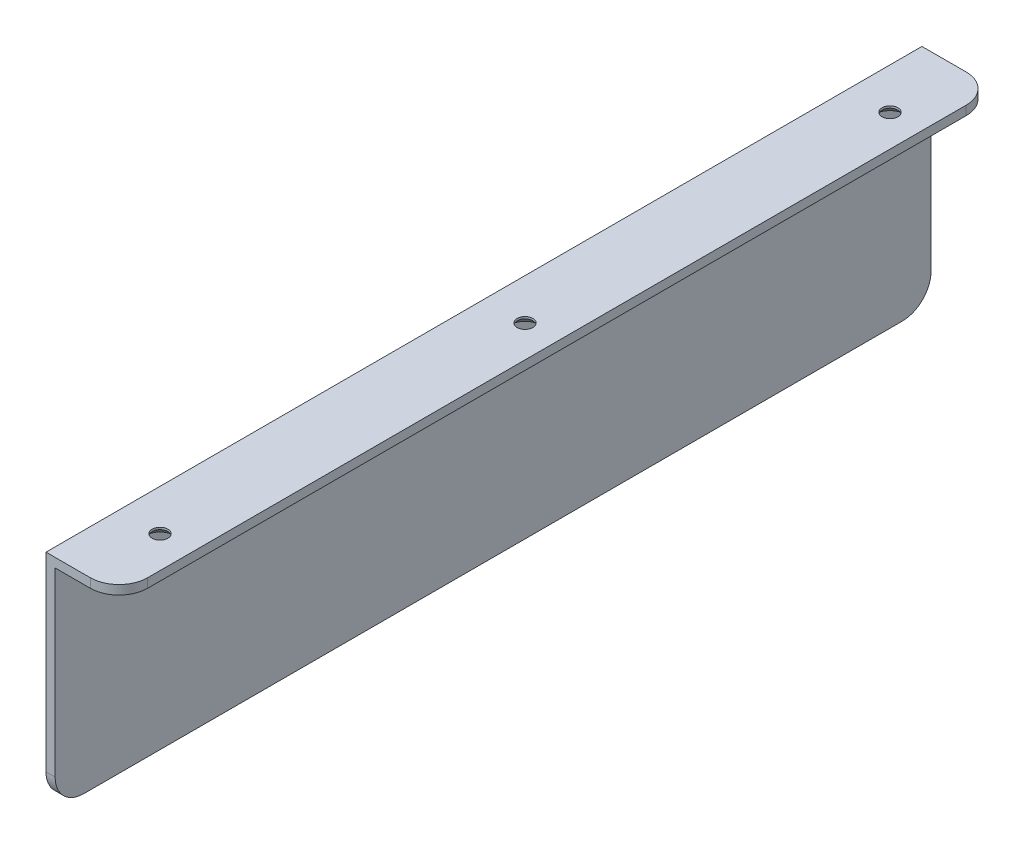
from build123d import *

# Parameters (mm, degrees)
EXTRUDE_THIN1_DEPTH                            = 152.4
CSK_FOR_M5_FLAT_HEAD_MACHINE_SCREW1_AT_2_COUNT = 2
CSK_FOR_M5_FLAT_HEAD_MACHINE_SCREW1_AT_2_PITCH = 127
CSK_FOR_M5_FLAT_HEAD_MACHINE_SCREW1_AT_3_COUNT = 2
CSK_FOR_M5_FLAT_HEAD_MACHINE_SCREW1_AT_3_PITCH = 254
FILLET1_R                                      = 10


with BuildPart() as part:
    # Sketch1 → Extrude-Thin1 (new, symmetric)
    with BuildSketch(Plane.XY):
        Polygon((0, 0), (-25.4, 0), (-25.4, -76.2), (-22.225, -76.2), (-22.225, -3.175), (0, -3.175), align=None)
    extrude(amount=EXTRUDE_THIN1_DEPTH, both=True)

    # Sketch3 → CSK for M5 Flat Head Machine Screw1 (revolve, cut)
    with BuildSketch(Plane(origin=(-11.1125, -3.175, 127), x_dir=(0, 0, -1), z_dir=(1, 0, 0))):
        Polygon((0, 0), (0, 3.175), (2.75, 3.175), (2.75, 2.45), (5.2, 0), align=None)
    csk_for_m5_flat_head_machine_screw1 = revolve(axis=Axis((-11.1125, -9.525, 127), (0, 1, 0)), mode=Mode.SUBTRACT)

    # CSK for M5 Flat Head Machine Screw1 at 2: CSK for M5 Flat Head Machine Screw1 ×2
    with Locations(*[(0, 0, -i * CSK_FOR_M5_FLAT_HEAD_MACHINE_SCREW1_AT_2_PITCH) for i in range(1, CSK_FOR_M5_FLAT_HEAD_MACHINE_SCREW1_AT_2_COUNT)]):
        add(csk_for_m5_flat_head_machine_screw1, mode=Mode.SUBTRACT)

    # CSK for M5 Flat Head Machine Screw1 at 3: CSK for M5 Flat Head Machine Screw1 ×2
    with Locations(*[(0, 0, -i * CSK_FOR_M5_FLAT_HEAD_MACHINE_SCREW1_AT_3_PITCH) for i in range(1, CSK_FOR_M5_FLAT_HEAD_MACHINE_SCREW1_AT_3_COUNT)]):
        add(csk_for_m5_flat_head_machine_screw1, mode=Mode.SUBTRACT)

    # Fillet1
    fillet1_edges = [part.edges().sort_by_distance(p)[0] for p in [
        (0, -1.5875, 152.4),
        (0, -1.5875, -152.4),
        (-23.8125, -76.2, -152.4),
        (-23.8125, -76.2, 152.4),
    ]]
    fillet(fillet1_edges, radius=FILLET1_R)


solid = part.part
